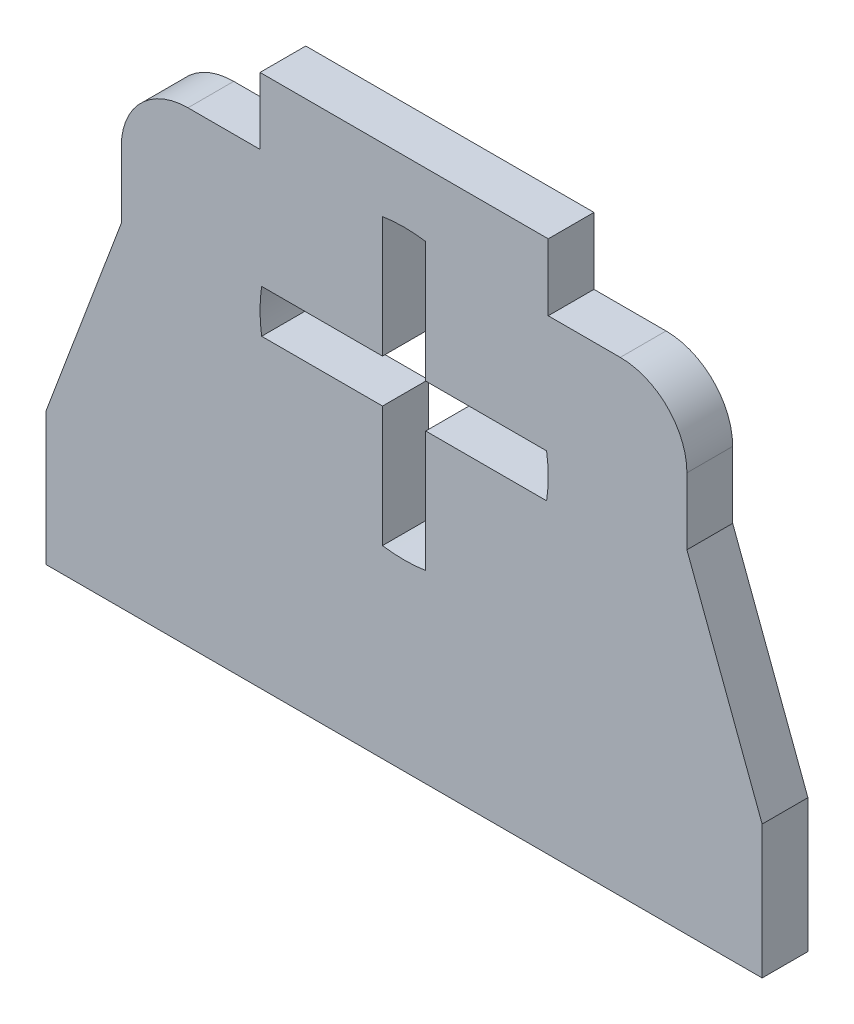
from build123d import *

# Parameters (mm, degrees)
SKETCH1_W           = 39.69
SKETCH1_H           = 3.175
BOSS_EXTRUDE1_DEPTH = 12.7
CUT_EXTRUDE1_DEPTH  = 12.7
SKETCH4_W           = 6.35
SKETCH4_H           = 0.4
CUT_EXTRUDE2_DEPTH  = 12.7
BOSS_EXTRUDE2_DEPTH = 3.175
CUT_EXTRUDE3_DEPTH  = 3.175
BOSS_EXTRUDE3_DEPTH = 3.175
CUT_EXTRUDE4_DEPTH  = 3.175


with BuildPart() as part:
    # Sketch1 → Boss-Extrude1 (new body)
    with BuildSketch(Plane(origin=(0, 0, 0), x_dir=(1, 0, 0), z_dir=(0, 1, 0))):
        Rectangle(SKETCH1_W, SKETCH1_H)
    extrude(amount=BOSS_EXTRUDE1_DEPTH)

    # Sketch3 → Cut-Extrude1 (cut)
    with BuildSketch(Plane.XY.offset(1.5875)):
        with BuildLine():
            ThreePointArc((-10.653064207, 7.9375), (-10.188096222, 9.060032015), (-9.065564207, 9.525))
            Line((-9.065564207, 9.525), (-1.5875, 9.525))
            Line((-1.5875, 9.525), (-1.5875, 12.7))
            Line((-1.5875, 12.7), (-19.845, 12.7))
            Line((-19.845, 12.7), (-19.845, 1.599044979))
            Line((-19.845, 1.599044979), (-10.653064207, 6.35))
            Line((-10.653064207, 6.35), (-10.653064207, 7.9375))
        make_face()
        with BuildLine():
            Line((19.845, 12.7), (1.5875, 12.7))
            Line((1.5875, 12.7), (1.5875, 9.525))
            Line((1.5875, 9.525), (9.065564207, 9.525))
            ThreePointArc((9.065564207, 9.525), (10.188096222, 9.060032015), (10.653064207, 7.9375))
            Line((10.653064207, 7.9375), (10.653064207, 6.35))
            Line((10.653064207, 6.35), (19.845, 3.175))
            Line((19.845, 3.175), (19.845, 12.7))
        make_face()
    extrude(amount=-CUT_EXTRUDE1_DEPTH, mode=Mode.SUBTRACT)

    # Sketch4 → Cut-Extrude2 (cut)
    with BuildSketch(Plane.XY.offset(1.5875)):
        with Locations((0, 6.35)):
            Rectangle(SKETCH4_W, SKETCH4_H)
        Polygon((-0.2, 9.525), (0.2, 9.525), (0.2, 3.175), (0, 3.175), (-0.2, 3.175), align=None)
    extrude(amount=-CUT_EXTRUDE2_DEPTH, mode=Mode.SUBTRACT)

    # Sketch5 → Boss-Extrude2 (add)
    with BuildSketch(Plane.XY.offset(1.5875)):
        with BuildLine():
            Line((1.5875, 9.525), (9.065564207, 9.525))
            ThreePointArc((9.065564207, 9.525), (10.188096222, 9.060032015), (10.653064207, 7.9375))
            Line((10.653064207, 7.9375), (10.653064207, 6.35))
            Line((10.653064207, 6.35), (19.845, 3.175))
            Line((19.845, 3.175), (19.845, 0))
            Line((19.845, 0), (24.845, 0))
            Line((24.845, 0), (24.845, 37))
            Line((24.845, 37), (-24.845, 37))
            Line((-24.845, 37), (-24.845, 0))
            Line((-24.845, 0), (-19.845, 0))
            Line((-19.845, 0), (-19.845, 1.599044979))
            Line((-19.845, 1.599044979), (-10.653064207, 6.35))
            Line((-10.653064207, 6.35), (-10.653064207, 7.9375))
            ThreePointArc((-10.653064207, 7.9375), (-10.188096222, 9.060032015), (-9.065564207, 9.525))
            Line((-9.065564207, 9.525), (-1.5875, 9.525))
            Line((-1.5875, 9.525), (-1.5875, 12.7))
            Line((-1.5875, 12.7), (1.5875, 12.7))
            Line((1.5875, 12.7), (1.5875, 9.525))
        make_face()
    extrude(amount=-BOSS_EXTRUDE2_DEPTH)

    # Sketch6 → Cut-Extrude3 (cut)
    with BuildSketch(Plane.XY.offset(1.5875)):
        with BuildLine():
            Line((-10, 37), (-24.845, 37))
            Line((-24.845, 37), (-24.845, 27.75))
            Line((-24.845, 27.75), (-24.845, 18.5))
            Line((-24.845, 18.5), (-24.845, 9.25))
            Line((-24.845, 9.25), (-19.625, 23.125))
            Line((-19.625, 23.125), (-19.625, 27.75))
            ThreePointArc((-19.625, 27.75), (-18.270368863, 31.020368863), (-15, 32.375))
            Line((-15, 32.375), (-10, 32.375))
            Line((-10, 32.375), (-10, 37))
        make_face()
        with BuildLine():
            Line((24.845, 37), (10, 37))
            Line((10, 37), (10, 32.375))
            Line((10, 32.375), (15, 32.375))
            ThreePointArc((15, 32.375), (18.270368863, 31.020368863), (19.625, 27.75))
            Line((19.625, 27.75), (19.625, 23.125))
            Line((19.625, 23.125), (24.845, 9.25))
            Line((24.845, 9.25), (24.845, 18.5))
            Line((24.845, 18.5), (24.845, 37))
        make_face()
    extrude(amount=-CUT_EXTRUDE3_DEPTH, mode=Mode.SUBTRACT)

    # Sketch7 → Boss-Extrude3 (add)
    with BuildSketch(Plane.XY.offset(1.5875)):
        Polygon((0.2, 6.15), (0.2, 3.175), (-0.2, 3.175), (-0.2, 6.15), (-3.175, 6.15), (-3.175, 6.55), (-0.2, 6.55), (-0.2, 9.525), (0.2, 9.525), (0.2, 6.55), (3.175, 6.55), (3.175, 6.15), align=None)
    extrude(amount=-BOSS_EXTRUDE3_DEPTH)

    # Sketch8 → Cut-Extrude4 (cut)
    with BuildSketch(Plane.XY.offset(1.5875)):
        with BuildLine():
            Line((1.5, 24.2), (1.5, 32.586859967))
            ThreePointArc((1.5, 32.586859967), (0, 32.7), (-1.5, 32.586859967))
            Line((-1.5, 32.586859967), (-1.5, 24.2))
            Line((-1.5, 24.2), (-9.886859967, 24.2))
            ThreePointArc((-9.886859967, 24.2), (-10, 22.7), (-9.886859967, 21.2))
            Line((-9.886859967, 21.2), (-1.5, 21.2))
            Line((-1.5, 21.2), (-1.5, 12.813140033))
            ThreePointArc((-1.5, 12.813140033), (-0.752130419, 12.728325124), (0, 12.7))
            ThreePointArc((0, 12.7), (0.752130419, 12.728325124), (1.5, 12.813140033))
            Line((1.5, 12.813140033), (1.5, 21.2))
            Line((1.5, 21.2), (9.886859967, 21.2))
            ThreePointArc((9.886859967, 21.2), (9.971674876, 21.947869581), (10, 22.7))
            ThreePointArc((10, 22.7), (9.971674876, 23.452130419), (9.886859967, 24.2))
            Line((9.886859967, 24.2), (1.5, 24.2))
        make_face()
    extrude(amount=-CUT_EXTRUDE4_DEPTH, mode=Mode.SUBTRACT)


solid = part.part
